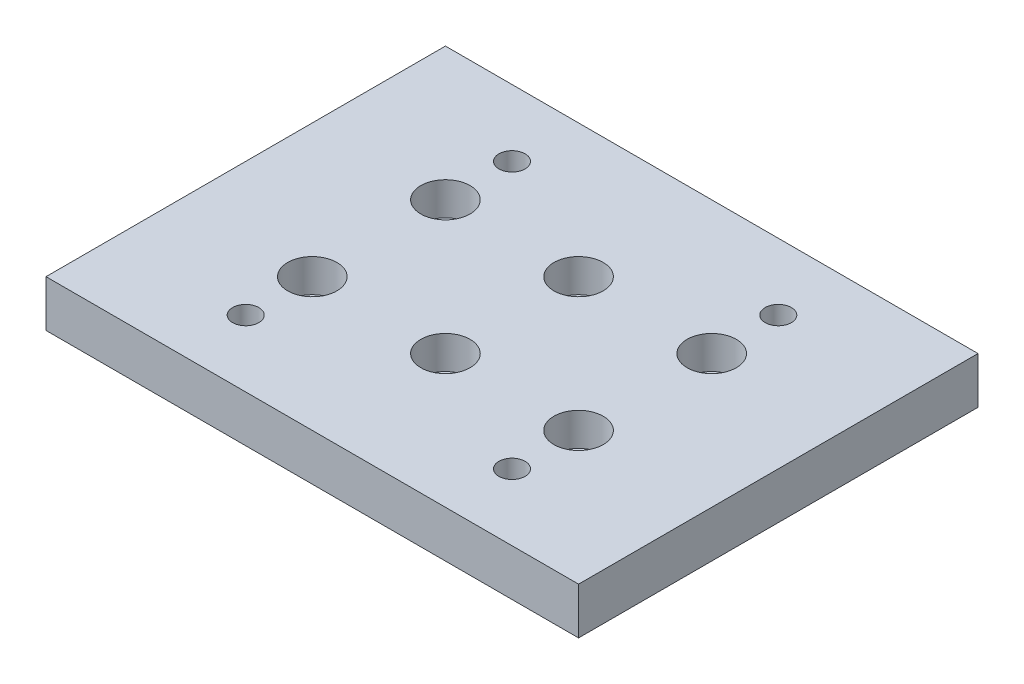
from build123d import *

# Parameters (mm, degrees)
SKETCH1_W                      = 101.6
SKETCH1_H                      = 76.2
BOSS_EXTRUDE1_DEPTH            = 8.89
TAP_DRILL_FOR_M6X1_0_TAP1_D    = 5
CBORE_FOR_M6_SHCS1_D           = 6.6
CBORE_FOR_M6_SHCS1_CBORE_D     = 9.4
CBORE_FOR_M6_SHCS1_CBORE_DEPTH = 6.3


with BuildPart() as part:
    # Sketch1 → Boss-Extrude1 (new body)
    with BuildSketch(Plane(origin=(0, 0, 0), x_dir=(1, 0, 0), z_dir=(0, 1, 0))):
        Rectangle(SKETCH1_W, SKETCH1_H)
    extrude(amount=BOSS_EXTRUDE1_DEPTH)

    # Tap Drill for M6x1.0 Tap1 (through all)
    with Locations(Plane(origin=(0, 8.89, 0), x_dir=(1, 0, 0), z_dir=(0, 1, 0))):
        with Locations((-25.4, 25.4), (25.4, 25.4), (25.4, -25.4), (-25.4, -25.4)):
            Hole(TAP_DRILL_FOR_M6X1_0_TAP1_D / 2)

    # CBORE for M6 SHCS1 (through all)
    with Locations(Plane(origin=(0, 8.89, 0), x_dir=(1, 0, 0), z_dir=(0, 1, 0))):
        with Locations((-25.4, 12.7), (-25.4, -12.7), (0, -12.7), (0, 12.7), (25.4, 12.7), (25.4, -12.7)):
            CounterBoreHole(CBORE_FOR_M6_SHCS1_D / 2, CBORE_FOR_M6_SHCS1_CBORE_D / 2, CBORE_FOR_M6_SHCS1_CBORE_DEPTH)


solid = part.part
